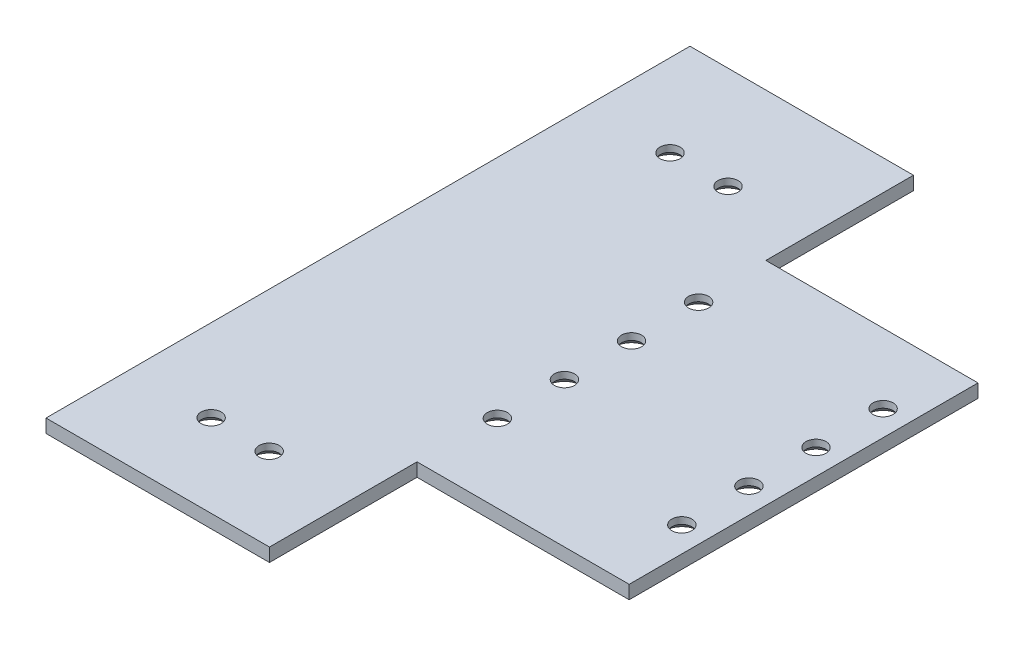
from build123d import *

# Parameters (mm, degrees)
SKETCH_1_W          = 17.893001423
SKETCH_1_H          = 11.620982588
SKETCH_1_H_2        = 11.620982589
EXTRUDE_1_DEPTH     = 2
SKETCH_2_R          = 1.5
CUT_EXTRUDE_1_DEPTH = 10
CHAMFER_1_SIZE      = 1
SKETCH_3_R          = 1.5
CUT_EXTRUDE_2_DEPTH = 10
SKETCH_4_W          = 33.95700602
SKETCH_4_H          = 96
CUT_EXTRUDE_3_DEPTH = 10
CHAMFER_2_SIZE      = 1


with BuildPart() as part:
    # Эскиз1 → Бобышка-Вытянуть1 (new body)
    with BuildSketch(Plane(origin=(0, 0, 0), x_dir=(1, 0, 0), z_dir=(0, 1, 0))):
        Polygon((49.933797981, 26), (18.309932441, 26), (18.309932441, 48), (15, 48), (-48.959081244, 48), (-48.959081244, -48), (15, -48), (18.309932441, -48), (18.309932441, -26), (49.933797981, -26), align=None)
        with Locations((-36.319088007, -31.12001489)):
            Rectangle(SKETCH_1_W, SKETCH_1_H, mode=Mode.SUBTRACT)
        with Locations((-36.319088007, 31.12001489)):
            Rectangle(SKETCH_1_W, SKETCH_1_H_2, mode=Mode.SUBTRACT)
    extrude(amount=EXTRUDE_1_DEPTH)

    # Эскиз2 → Вырез-Вытянуть1 (cut)
    with BuildSketch(Plane(origin=(0, 2, 0), x_dir=(1, 0, 0), z_dir=(0, 1, 0))):
        with Locations(Location((46.183797981, -14.4, 0), (0, 0, 270))):
            Circle(SKETCH_2_R)
        with Locations(Location((18.683797981, -14.4, 0), (0, 0, 270))):
            Circle(SKETCH_2_R)
        with Locations(Location((18.683797981, -4.4, 0), (0, 0, 270))):
            Circle(SKETCH_2_R)
        with Locations(Location((46.183797981, -4.4, 0), (0, 0, 270))):
            Circle(SKETCH_2_R)
        with Locations(Location((18.683797981, 5.6, 0), (0, 0, 270))):
            Circle(SKETCH_2_R)
        with Locations(Location((46.183797981, 5.6, 0), (0, 0, 270))):
            Circle(SKETCH_2_R)
        with Locations(Location((18.683797981, 15.6, 0), (0, 0, 270))):
            Circle(SKETCH_2_R)
        with Locations(Location((46.183797981, 15.6, 0), (0, 0, 270))):
            Circle(SKETCH_2_R)
    extrude(amount=-CUT_EXTRUDE_1_DEPTH, mode=Mode.SUBTRACT)

    # Фаска1
    chamfer_1_edges = [part.edges().sort_by_distance(p)[0] for p in [
        (46.183797981, 0, -7.1),
        (18.683797981, 0, 2.9),
        (46.183797981, 0, 2.9),
        (18.683797981, 0, 12.9),
        (18.683797981, 0, -17.1),
        (46.183797981, 0, -17.1),
        (18.683797981, 0, -7.1),
        (46.183797981, 0, 12.9),
    ]]
    chamfer(chamfer_1_edges, length=CHAMFER_1_SIZE)

    # Эскиз3 → Вырез-Вытянуть2 (cut)
    with BuildSketch(Plane(origin=(0, 2, 0), x_dir=(1, 0, 0), z_dir=(0, 1, 0))):
        with Locations(Location((5.923569009, 32.746976788, 0), (0, 0, 270))):
            Circle(SKETCH_3_R)
        with Locations(Location((-2.726430991, 32.746976788, 0), (0, 0, 270))):
            Circle(SKETCH_3_R)
        with Locations(Location((-2.726430991, -35.660220789, 0), (0, 0, 270))):
            Circle(SKETCH_3_R)
        with Locations(Location((5.923569009, -35.660220789, 0), (0, 0, 270))):
            Circle(SKETCH_3_R)
    extrude(amount=-CUT_EXTRUDE_2_DEPTH, mode=Mode.SUBTRACT)

    # Эскиз4 → Вырез-Вытянуть3 (cut)
    with BuildSketch(Plane(origin=(0, 2, 0), x_dir=(1, 0, 0), z_dir=(0, 1, 0))):
        with Locations((-31.980578234, 0)):
            Rectangle(SKETCH_4_W, SKETCH_4_H)
    extrude(amount=-CUT_EXTRUDE_3_DEPTH, mode=Mode.SUBTRACT)

    # Фаска2
    chamfer_2_edges = [part.edges().sort_by_distance(p)[0] for p in [
        (5.923569009, 0, 34.160220789),
        (-2.726430991, 0, 34.160220789),
        (-2.726430991, 0, -34.246976788),
        (5.923569009, 0, -34.246976788),
    ]]
    chamfer(chamfer_2_edges, length=CHAMFER_2_SIZE)


solid = part.part
